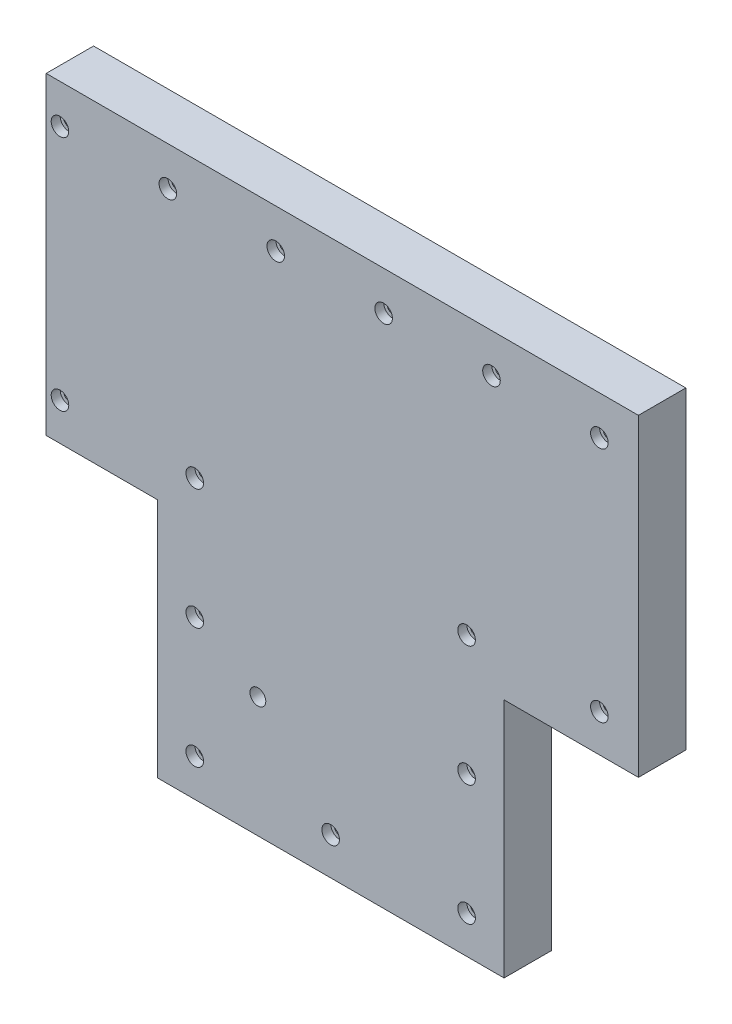
from build123d import *

# Parameters (mm, degrees)
SKETCH10_R                                     = 2.5
BOSS_EXTRUDE2_DEPTH                            = 6.35
CBORE_FOR_4_SOCKET_HEAD_CAP_SCREW1_D           = 3.2639
CBORE_FOR_4_SOCKET_HEAD_CAP_SCREW1_CBORE_D     = 5.55752
CBORE_FOR_4_SOCKET_HEAD_CAP_SCREW1_CBORE_DEPTH = 2.8448
BOSS_EXTRUDE3_START                            = 6.35
BOSS_EXTRUDE3_DEPTH                            = 15
BOSS_EXTRUDE6_START                            = 6.35
BOSS_EXTRUDE6_DEPTH                            = 3.175


with BuildPart() as part:
    # Sketch10 → Boss-Extrude2 (new body)
    # profile 1 of 10: a face of its own
    with BuildSketch(Plane.XY):
        Polygon((180, 10), (0, 10), (0, 0), (55.075212776, 0), (62.146280588, 0), (64.974707713, 0), (72.045775525, 0), (170, 0), (170, -65), (137.045775525, -65), (129.974707713, -65), (128, -65), (128, -141.2), (52, -141.2), (52, -65), (0, -65), (0, -75), (42, -75), (42, -151.2), (138, -151.2), (138, -75), (180, -75), align=None)
    # profile 2 of 10: a face of its own
    with BuildSketch(Plane.XY):
        Polygon((0, 13.175), (0, 10), (180, 10), (180, -75), (138, -75), (138, -151.2), (42, -151.2), (42, -75), (0, -75), (0, -78.175), (38.825, -78.175), (38.825, -154.375), (141.175, -154.375), (141.175, -78.175), (183.175, -78.175), (183.175, 13.175), align=None)
    # profile 3 of 10: a face of its own
    with BuildSketch(Plane.XY):
        Polygon((55.075212776, 0), (0, 0), (0, -65), (52, -65), (52, -141.2), (128, -141.2), (128, -65), (127.146280588, -65), (120.075212776, -65), (57.075212776, -2), align=None)
        with Locations((66.974707713, -119.977801383)):
            Circle(SKETCH10_R, mode=Mode.SUBTRACT)
    # profile 4 of 10: a face of its own
    with BuildSketch(Plane.XY):
        Polygon((62.146280588, 0), (55.075212776, 0), (57.075212776, -2), (64.146280588, -2), align=None)
    # profile 5 of 10: a face of its own
    with BuildSketch(Plane.XY):
        Polygon((64.974707713, 0), (62.146280588, 0), (64.146280588, -2), (127.146280588, -65), (128, -65), (129.974707713, -65), (127.974707713, -63), (66.974707713, -2), align=None)
    # profile 6 of 10: a face of its own
    with BuildSketch(Plane.XY):
        Polygon((64.146280588, -2), (57.075212776, -2), (120.075212776, -65), (127.146280588, -65), align=None)
    # profile 7 of 10: a face of its own
    with BuildSketch(Plane.XY):
        Polygon((72.045775525, 0), (64.974707713, 0), (66.974707713, -2), (74.045775525, -2), align=None)
    # profile 8 of 10: a face of its own
    with BuildSketch(Plane.XY):
        Polygon((170, 0), (72.045775525, 0), (74.045775525, -2), (135.045775525, -63), (137.045775525, -65), (170, -65), align=None)
    # profile 9 of 10: a face of its own
    with BuildSketch(Plane.XY):
        Polygon((74.045775525, -2), (66.974707713, -2), (127.974707713, -63), (135.045775525, -63), align=None)
    # profile 10 of 10: a face of its own
    with BuildSketch(Plane.XY):
        Polygon((135.045775525, -63), (127.974707713, -63), (129.974707713, -65), (137.045775525, -65), align=None)
    extrude(amount=BOSS_EXTRUDE2_DEPTH)

    # CBORE for #4 Socket Head Cap Screw1 (through all)
    with Locations(Plane(origin=(4.3688, 5, 6.35), x_dir=(1, 0, 0), z_dir=(0, 0, 1))):
        with Locations((0, 0), (34.12624, 0), (68.25248, 0), (102.37872, 0), (136.50496, 0), (170.6312, 0), (170.6312, -75), (128.6312, -75), (128.6312, -113.1), (128.6312, -151.2), (85.6312, -151.2), (42.6312, -151.2), (42.6312, -113.1), (42.6312, -75), (0, -75)):
            CounterBoreHole(CBORE_FOR_4_SOCKET_HEAD_CAP_SCREW1_D / 2, CBORE_FOR_4_SOCKET_HEAD_CAP_SCREW1_CBORE_D / 2, CBORE_FOR_4_SOCKET_HEAD_CAP_SCREW1_CBORE_DEPTH)



with BuildPart() as body_2:
    # Sketch13 → Boss-Extrude3 (new body)
    with BuildSketch(Plane.XY.offset(BOSS_EXTRUDE3_START)):
        Polygon((187.35, 17.35), (0, 17.35), (0, 13.675), (183.675, 13.675), (183.675, -78.675), (141.675, -78.675), (141.675, -154.875), (38.325, -154.875), (38.325, -78.675), (0, -78.675), (0, -81.85), (35.15, -81.85), (35.15, -158.05), (144.85, -158.05), (144.85, -81.85), (187.35, -81.85), align=None)
    extrude(amount=-BOSS_EXTRUDE3_DEPTH)


with BuildPart() as part_1:
    add(part.part)

    add(body_2.part)  # Boss-Extrude6 merges body 2
    # Sketch13<7> → Boss-Extrude6 (add)
    with BuildSketch(Plane.XY.offset(BOSS_EXTRUDE6_START)):
        Polygon((138, -75), (180, -75), (180, 10), (0, 10), (0, 13.175), (183.175, 13.175), (183.175, -78.175), (141.175, -78.175), (141.175, -154.375), (38.825, -154.375), (38.825, -78.175), (0, -78.175), (0, -75), (42, -75), (42, -151.2), (138, -151.2), align=None)
        Polygon((183.175, 13.175), (0, 13.175), (0, 13.675), (183.675, 13.675), (183.675, -78.675), (141.675, -78.675), (141.675, -154.875), (38.325, -154.875), (38.325, -78.675), (0, -78.675), (0, -78.175), (38.825, -78.175), (38.825, -154.375), (141.175, -154.375), (141.175, -78.175), (183.175, -78.175), align=None)
    extrude(amount=-BOSS_EXTRUDE6_DEPTH)


solid = part_1.part
